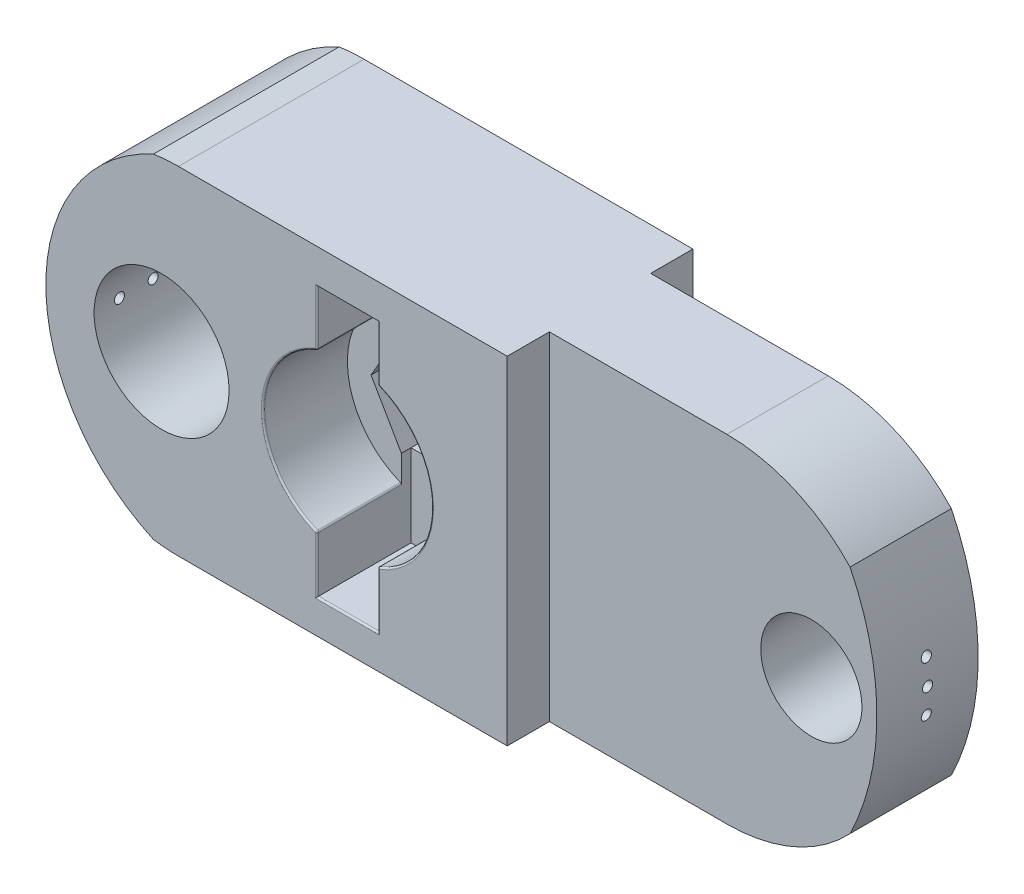
from build123d import *

# Parameters (mm, degrees)
SKETCH_1_R           = 40
EXTRUDE_1_DEPTH      = 110
SKETCH_2_R           = 3
CUT_EXTRUDE_2_DEPTH  = 150
SKETCH_3_R           = 50
CUT_EXTRUDE_3_DEPTH  = 50
CUT_EXTRUDE_4_DEPTH  = 10
SKETCH_5_W           = 36
SKETCH_5_H           = 160
CUT_EXTRUDE_7_DEPTH  = 122
CUT_EXTRUDE_8_DEPTH  = 10
SKETCH_7_R           = 3
CUT_EXTRUDE_9_DEPTH  = 10
EXTRUDE_START        = 4.3
EXTRUDE_2_DEPTH      = 4.3
SKETCH_11_W          = 36
SKETCH_11_H          = 48.823085464
SKETCH_11_R          = 3
EXTRUDE_3_DEPTH      = 4.3
CUT_EXTRUDE_START    = -200
CUT_EXTRUDE_16_DEPTH = 200
FILLET_2_R           = 1
CUT_EXTRUDE_START_2  = -25
CUT_EXTRUDE_17_DEPTH = 25
SKETCH_16_R          = 30
CUT_EXTRUDE_18_DEPTH = 100
SKETCH_17_R          = 100
CUT_EXTRUDE_19_DEPTH = 25
CUT_EXTRUDE_START_3  = -100
CUT_EXTRUDE_20_DEPTH = 100
SKETCH_19_W          = 186.41721719
SKETCH_19_H          = 278.516199491
CUT_EXTRUDE_21_DEPTH = 25
CUT_EXTRUDE_START_4  = 500
SKETCH_20_R          = 3
CUT_EXTRUDE_22_DEPTH = 500


with BuildPart() as part:
    # 草图1 → 凸台-拉伸1 (new body)
    with BuildSketch(Plane.XY):
        with BuildLine():
            Line((-100.092421442, 100), (199.907578558, 100))
            ThreePointArc((199.907578558, 100), (299.907578558, 0), (199.907578558, -100))
            Line((199.907578558, -100), (-100.092421442, -100))
            ThreePointArc((-100.092421442, -100), (-200.092421442, 0), (-100.092421442, 100))
        make_face()
        with Locations((-110.092421442, 0)):
            Circle(SKETCH_1_R, mode=Mode.SUBTRACT)
    extrude(amount=EXTRUDE_1_DEPTH)

    # 草图2 → 切除-拉伸2 (cut)
    with BuildSketch(Plane(origin=(-100, 0, 0), x_dir=(0, 0, -1), z_dir=(1, 0, 0))):
        with Locations((-95, 0)):
            Circle(SKETCH_2_R)
        with Locations((-75, 0)):
            Circle(SKETCH_2_R)
        with Locations((-55, 0)):
            Circle(SKETCH_2_R)
    extrude(amount=-CUT_EXTRUDE_2_DEPTH, mode=Mode.SUBTRACT)

    # 草图3 → 切除-拉伸3 (cut)
    with BuildSketch(Plane.XY.offset(110)):
        Circle(SKETCH_3_R)
    extrude(amount=-CUT_EXTRUDE_3_DEPTH, mode=Mode.SUBTRACT)

    # 草图4 → 切除-拉伸4 (cut)
    with BuildSketch(Plane.XY.offset(60)):
        Polygon((36, 0), (18, 31.176914536), (-18, 31.176914536), (-36, 0), (-18, -31.176914536), (18, -31.176914536), align=None)
    extrude(amount=-CUT_EXTRUDE_4_DEPTH, mode=Mode.SUBTRACT)

    # 草图5 → 切除-拉伸7 (cut)
    with BuildSketch(Plane.XY.offset(50)):
        Rectangle(SKETCH_5_W, SKETCH_5_H)
    extrude(amount=CUT_EXTRUDE_7_DEPTH, mode=Mode.SUBTRACT)

    # 草图6 → 切除-拉伸8 (cut)
    with BuildSketch(Plane.XY.offset(50)):
        Polygon((36, 0), (18, 31.176914536), (-18, 31.176914536), (-36, 0), (-18, -31.176914536), (18, -31.176914536), align=None)
    extrude(amount=-CUT_EXTRUDE_8_DEPTH, mode=Mode.SUBTRACT)

    # 草图7 → 切除-拉伸9 (cut)
    with BuildSketch(Plane.XY.offset(50)):
        with Locations((0, 62)):
            Circle(SKETCH_7_R)
    cut_extrude_9 = extrude(amount=-CUT_EXTRUDE_9_DEPTH, mode=Mode.SUBTRACT)

    # 镜向1: 切除-拉伸9 across plane
    add(cut_extrude_9.mirror(Plane.ZX), mode=Mode.SUBTRACT)

    # 草图10 → 凸台-拉伸2 (add)
    with BuildSketch(Plane.XY.offset(40).offset(EXTRUDE_START)):
        with BuildLine():
            Line((36, 0), (18, -31.176914536))
            Line((18, -31.176914536), (18, -46.647615159))
            ThreePointArc((18, -46.647615159), (50, 0), (18, 46.647615159))
            Line((18, 46.647615159), (18, 31.176914536))
            Line((18, 31.176914536), (36, 0))
        make_face()
        with BuildLine():
            Line((-18, -46.647615159), (-18, -31.176914536))
            Line((-18, -31.176914536), (-36, 0))
            Line((-36, 0), (-18, 31.176914536))
            Line((-18, 31.176914536), (-18, 46.647615159))
            ThreePointArc((-18, 46.647615159), (-50, 0), (-18, -46.647615159))
        make_face()
    extrude(amount=-EXTRUDE_2_DEPTH)

    # 草图11 → 凸台-拉伸3 (add)
    with BuildSketch(Plane.XY.offset(50).offset(EXTRUDE_START)):
        with Locations((0, 55.588457268)):
            Rectangle(SKETCH_11_W, SKETCH_11_H)
        with Locations((0, 62)):
            Circle(SKETCH_11_R, mode=Mode.SUBTRACT)
    extrude_3 = extrude(amount=-EXTRUDE_3_DEPTH)

    # 镜向4: 凸台-拉伸3 across plane
    add(extrude_3.mirror(Plane.ZX))

    # 草图14 → 切除-拉伸16 (cut)
    with BuildSketch(Plane.XY.offset(110).offset(CUT_EXTRUDE_START)):
        with BuildLine():
            ThreePointArc((-114.938685096, -98.891801761), (-178.67776032, 0), (-114.938685096, 98.891801761))
            ThreePointArc((-114.938685096, 98.891801761), (-200.092421442, 0), (-114.938685096, -98.891801761))
        make_face()
    extrude(amount=CUT_EXTRUDE_16_DEPTH, mode=Mode.SUBTRACT)

    # 圆角2
    fillet_2_edges = [part.edges().sort_by_distance(p)[0] for p in [
        (18, 46.647615159, 85),
        (18, 63.323807579, 110),
        (-18, 63.323807579, 110),
        (-18, 46.647615159, 85),
        (-18, -46.647615159, 85),
        (-50, 0, 110),
        (-18, -63.323807579, 110),
        (0, -80, 110),
        (18, -46.647615159, 85),
        (18, -63.323807579, 110),
        (50, 0, 110),
    ]]
    fillet(fillet_2_edges, radius=FILLET_2_R)

    # 草图15 → 切除-拉伸17 (cut)
    with BuildSketch(Plane.XY.offset(110).offset(CUT_EXTRUDE_START_2)):
        with BuildLine():
            ThreePointArc((299.907578558, 0), (270.618256677, 70.710678119), (199.907578558, 100))
            Line((199.907578558, 100), (199.907578558, -100))
            ThreePointArc((199.907578558, -100), (270.618256677, -70.710678119), (299.907578558, 0))
        make_face()
    cut_extrude_17 = extrude(amount=CUT_EXTRUDE_17_DEPTH, mode=Mode.SUBTRACT)

    # 镜向5: 切除-拉伸17 across plane
    add(cut_extrude_17.mirror(Plane.XY.offset(55)), mode=Mode.SUBTRACT)

    # 草图16 → 切除-拉伸18 (cut)
    with BuildSketch(Plane.XY.offset(85)):
        with Locations((249.907578558, 0)):
            Circle(SKETCH_16_R)
    extrude(amount=-CUT_EXTRUDE_18_DEPTH, mode=Mode.SUBTRACT)

    # 草图17 → 切除-拉伸19 (cut)
    with BuildSketch(Plane.XY.offset(110).offset(CUT_EXTRUDE_START_2)):
        with Locations((199.907578558, 0)):
            Circle(SKETCH_17_R)
    cut_extrude_19 = extrude(amount=CUT_EXTRUDE_19_DEPTH, mode=Mode.SUBTRACT)

    # 镜向6: 切除-拉伸19 across plane
    add(cut_extrude_19.mirror(Plane.XY.offset(55)), mode=Mode.SUBTRACT)

    # 草图18 → 切除-拉伸20 (cut)
    with BuildSketch(Plane.XY.offset(85).offset(CUT_EXTRUDE_START_3)):
        with BuildLine():
            ThreePointArc((272.856353648, 68.399387519), (284.723437561, 35.110699351), (288.748761353, 0))
            ThreePointArc((288.748761353, 0), (284.723437561, -35.110699351), (272.856353648, -68.399387519))
            ThreePointArc((272.856353648, -68.399387519), (299.907578558, 0), (272.856353648, 68.399387519))
        make_face()
    extrude(amount=CUT_EXTRUDE_20_DEPTH, mode=Mode.SUBTRACT)

    # 草图19 → 切除-拉伸21 (cut)
    with BuildSketch(Plane.XY.offset(110)):
        with Locations((187.913249079, -8.044790623)):
            Rectangle(SKETCH_19_W, SKETCH_19_H)
    cut_extrude_21 = extrude(amount=-CUT_EXTRUDE_21_DEPTH, mode=Mode.SUBTRACT)

    # 镜向7: 切除-拉伸21 across plane
    add(cut_extrude_21.mirror(Plane.XY.offset(55)), mode=Mode.SUBTRACT)

    # 草图20 → 切除-拉伸22 (cut)
    with BuildSketch(Plane(origin=(230, 0, 0), x_dir=(0, 0, -1), z_dir=(1, 0, 0)).offset(CUT_EXTRUDE_START_4)):
        with Locations((-55, 0)):
            Circle(SKETCH_20_R)
        with Locations((-55, 15)):
            Circle(SKETCH_20_R)
        with Locations((-55, -15)):
            Circle(SKETCH_20_R)
    extrude(amount=-CUT_EXTRUDE_22_DEPTH, mode=Mode.SUBTRACT)


solid = part.part
